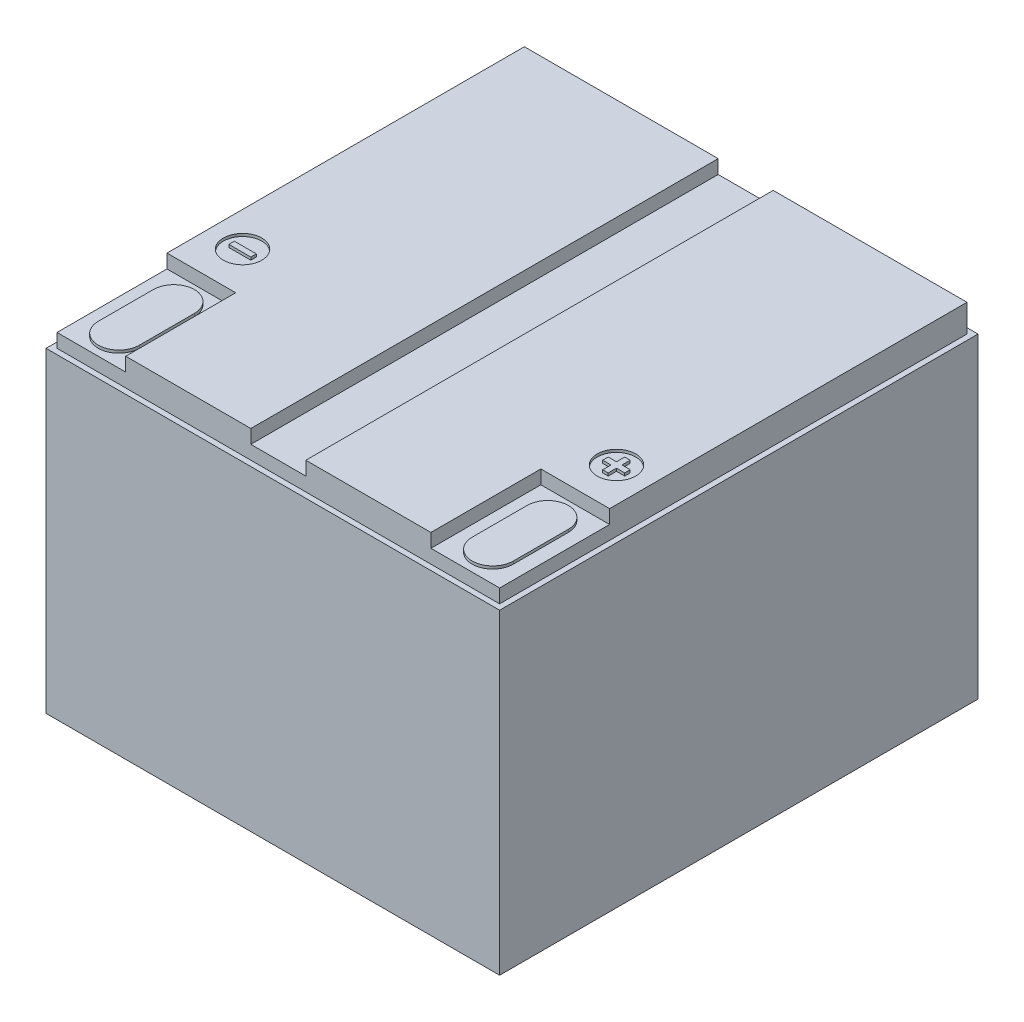
from build123d import *

# Parameters (mm, degrees)
SKETCH1_R             = 7
BOSS_EXTRUDE3_DEPTH   = 125
BOSS_EXTRUDE3_2_DEPTH = 125
SKETCH1_W             = 8
SKETCH1_H             = 2
BOSS_EXTRUDE3_3_DEPTH = 125
BOSS_EXTRUDE3_4_DEPTH = 125
SKETCH1_6_R           = 7
BOSS_EXTRUDE4_DEPTH   = 124
SKETCH1_7_W           = 20
SKETCH1_7_H           = 170
SKETCH1_7_W_2         = 25
SKETCH1_7_H_2         = 40
BOSS_EXTRUDE5_DEPTH   = 120
BOSS_EXTRUDE6_DEPTH   = 121
SKETCH1_10_W          = 165
SKETCH1_10_H          = 174
BOSS_EXTRUDE7_DEPTH   = 115


with BuildPart() as part:
    # Sketch1 → Boss-Extrude3 (new body)
    with BuildSketch(Plane(origin=(0, 0, 0), x_dir=(1, 0, 0), z_dir=(0, 1, 0))):
        Polygon((80.5, -45), (80.5, 85), (10, 85), (10, -85), (55.5, -85), (55.5, -45), align=None)
        with Locations((68, -30)):
            Circle(SKETCH1_R, mode=Mode.SUBTRACT)
    extrude(amount=BOSS_EXTRUDE3_DEPTH)



with BuildPart() as body_2:
    # Sketch1 → Boss-Extrude3 2 (new body)
    with BuildSketch(Plane(origin=(0, 0, 0), x_dir=(1, 0, 0), z_dir=(0, 1, 0))):
        Polygon((-10, -85), (-10, 85), (-80.5, 85), (-80.5, -45), (-55.5, -45), (-55.5, -85), align=None)
        with Locations((-68, -30)):
            Circle(SKETCH1_R, mode=Mode.SUBTRACT)
    extrude(amount=BOSS_EXTRUDE3_2_DEPTH)


with BuildPart() as body_3:
    # Sketch1 → Boss-Extrude3 3 (new body)
    with BuildSketch(Plane(origin=(0, 0, 0), x_dir=(1, 0, 0), z_dir=(0, 1, 0))):
        with Locations((-68, -30)):
            Rectangle(SKETCH1_W, SKETCH1_H)
    extrude(amount=BOSS_EXTRUDE3_3_DEPTH)


with BuildPart() as body_4:
    # Sketch1 → Boss-Extrude3 4 (new body)
    with BuildSketch(Plane(origin=(0, 0, 0), x_dir=(1, 0, 0), z_dir=(0, 1, 0))):
        Polygon((72, -31), (72, -29), (69, -29), (69, -26), (67, -26), (67, -29), (64, -29), (64, -31), (67, -31), (67, -34), (69, -34), (69, -31), align=None)
    extrude(amount=BOSS_EXTRUDE3_4_DEPTH)


with BuildPart() as part_1:
    add(part.part)

    add(body_2.part)  # Boss-Extrude4 merges body 2

    add(body_3.part)  # Boss-Extrude4 merges body 3

    add(body_4.part)  # Boss-Extrude4 merges body 4
    # Sketch1<6> → Boss-Extrude4 (add)
    with BuildSketch(Plane(origin=(0, 0, 0), x_dir=(1, 0, 0), z_dir=(0, 1, 0))):
        with Locations((-68, -30)):
            Circle(SKETCH1_6_R)
        with Locations((68, -30)):
            Circle(SKETCH1_6_R)
    extrude(amount=BOSS_EXTRUDE4_DEPTH)

    # Sketch1<7> → Boss-Extrude5 (add)
    # profile 1 of 3: a face of its own
    with BuildSketch(Plane(origin=(0, 0, 0), x_dir=(1, 0, 0), z_dir=(0, 1, 0))):
        Rectangle(SKETCH1_7_W, SKETCH1_7_H)
    # profile 2 of 3: a face of its own
    with BuildSketch(Plane(origin=(0, 0, 0), x_dir=(1, 0, 0), z_dir=(0, 1, 0))):
        with Locations((68, -65)):
            Rectangle(SKETCH1_7_W_2, SKETCH1_7_H_2)
        with BuildLine():
            Line((60.5, -75), (60.5, -55))
            ThreePointArc((60.5, -55), (68, -47.5), (75.5, -55))
            Line((75.5, -55), (75.5, -75))
            ThreePointArc((75.5, -75), (68, -82.5), (60.5, -75))
        make_face(mode=Mode.SUBTRACT)
    # profile 3 of 3: a face of its own
    with BuildSketch(Plane(origin=(0, 0, 0), x_dir=(1, 0, 0), z_dir=(0, 1, 0))):
        with Locations((-68, -65)):
            Rectangle(SKETCH1_7_W_2, SKETCH1_7_H_2)
        with BuildLine():
            ThreePointArc((-75.5, -55), (-68, -47.5), (-60.5, -55))
            Line((-60.5, -55), (-60.5, -75))
            ThreePointArc((-60.5, -75), (-68, -82.5), (-75.5, -75))
            Line((-75.5, -75), (-75.5, -55))
        make_face(mode=Mode.SUBTRACT)
    extrude(amount=BOSS_EXTRUDE5_DEPTH)

    # Sketch1<8> → Boss-Extrude6 (add)
    with BuildSketch(Plane(origin=(0, 0, 0), x_dir=(1, 0, 0), z_dir=(0, 1, 0))):
        with BuildLine():
            Line((-60.5, -75), (-60.5, -55))
            ThreePointArc((-60.5, -55), (-68, -47.5), (-75.5, -55))
            Line((-75.5, -55), (-75.5, -75))
            ThreePointArc((-75.5, -75), (-68, -82.5), (-60.5, -75))
        make_face()
        with BuildLine():
            ThreePointArc((75.5, -55), (68, -47.5), (60.5, -55))
            Line((60.5, -55), (60.5, -75))
            ThreePointArc((60.5, -75), (68, -82.5), (75.5, -75))
            Line((75.5, -75), (75.5, -55))
        make_face()
    extrude(amount=BOSS_EXTRUDE6_DEPTH)

    # Sketch1<10> → Boss-Extrude7 (add)
    with BuildSketch(Plane(origin=(0, 0, 0), x_dir=(1, 0, 0), z_dir=(0, 1, 0))):
        Rectangle(SKETCH1_10_W, SKETCH1_10_H)
    extrude(amount=BOSS_EXTRUDE7_DEPTH)


solid = part_1.part
